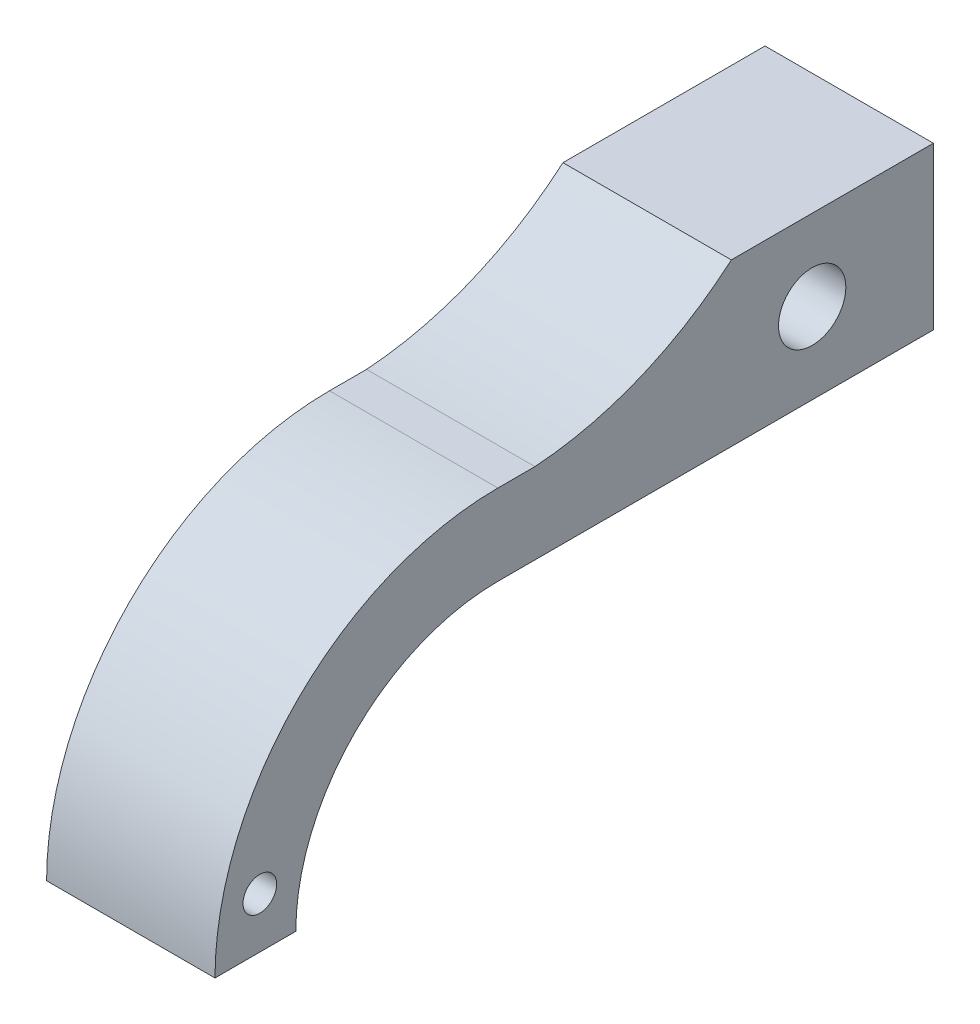
from build123d import *

# Parameters (mm, degrees)
BOSS_EXTRUDE6_DEPTH = 25
SKETCH3_R           = 5
CUT_EXTRUDE1_DEPTH  = 96.096384068
SKETCH4_R           = 2.5
CUT_EXTRUDE2_DEPTH  = 96.096384068


with BuildPart() as part:
    # Sketch2 → Boss-Extrude6 (new body)
    with BuildSketch(Plane(origin=(0, 0, 0), x_dir=(0, 0, -1), z_dir=(1, 0, 0))):
        with BuildLine():
            Line((-32.496153619, -2.925741651), (-38, -2.925741651))
            ThreePointArc((-38, -2.925741651), (-67.69848481, -15.227256841), (-80, -44.925741651))
            Line((-80, -44.925741651), (-68, -44.925741651))
            ThreePointArc((-68, -44.925741651), (-59.213203436, -23.712538215), (-38, -14.925741651))
            Line((-38, -14.925741651), (-22.688150378, -14.925741651))
            Line((-22.688150378, -14.925741651), (26.657177064, -14.925741651))
            Line((26.657177064, -14.925741651), (26.657177064, 9.074258349))
            Line((26.657177064, 9.074258349), (-3.342822936, 9.074258349))
            ThreePointArc((-3.342822936, 9.074258349), (-16.948948047, 0.716384993), (-32.496153619, -2.925741651))
        make_face()
    extrude(amount=BOSS_EXTRUDE6_DEPTH)

    # Sketch3 → Cut-Extrude1 (cut, through all)
    with BuildSketch(Plane(origin=(25, 0, 0), x_dir=(0, 0, -1), z_dir=(1, 0, 0))):
        with Locations((8.657177064, -2.925741651)):
            Circle(SKETCH3_R)
    extrude(amount=-CUT_EXTRUDE1_DEPTH, mode=Mode.SUBTRACT)

    # Sketch4 → Cut-Extrude2 (cut, through all)
    with BuildSketch(Plane(origin=(25, 0, 0), x_dir=(0, 0, -1), z_dir=(1, 0, 0))):
        with Locations((-73.342822936, -37.425741651)):
            Circle(SKETCH4_R)
    extrude(amount=-CUT_EXTRUDE2_DEPTH, mode=Mode.SUBTRACT)


solid = part.part
